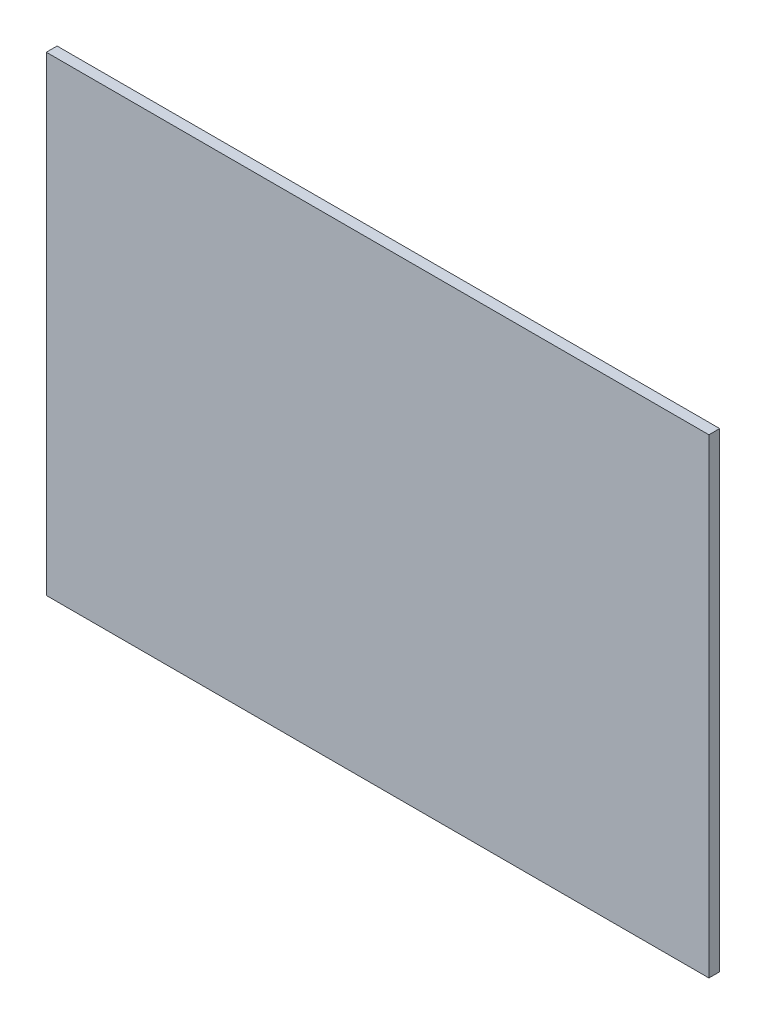
from build123d import *

# Parameters (mm, degrees)
SKETCH_1_W      = 369
SKETCH_1_H      = 262
EXTRUDE_1_DEPTH = 6


with BuildPart() as part:
    # Эскиз1 → Бобышка-Вытянуть1 (new body)
    with BuildSketch(Plane.XY):
        with Locations((300, 179)):
            Rectangle(SKETCH_1_W, SKETCH_1_H)
    extrude(amount=EXTRUDE_1_DEPTH)


solid = part.part
